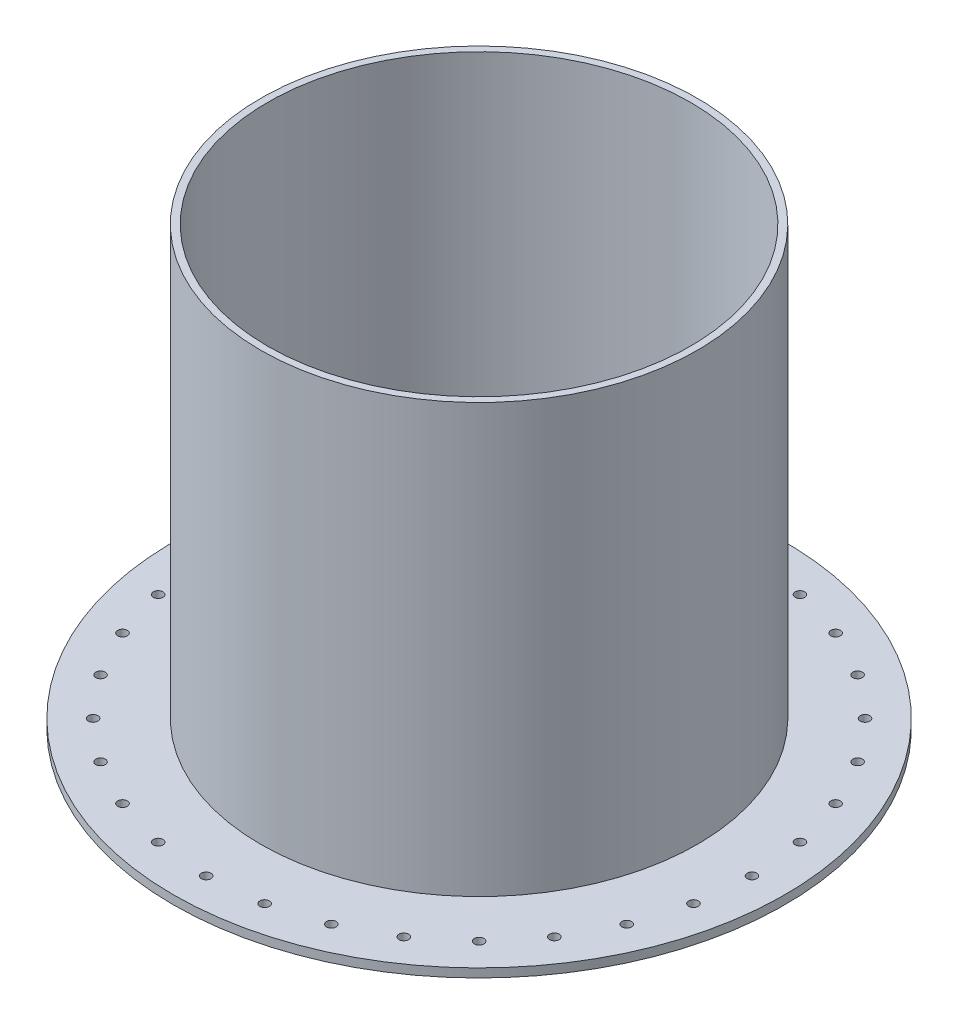
from build123d import *

# Parameters (mm, degrees)
SKETCH1_R           = 500
SKETCH1_R_2         = 484
BOSS_EXTRUDE1_DEPTH = 1000
SKETCH2_R           = 700
SKETCH2_R_2         = 450
SKETCH2_R_3         = 11
BOSS_EXTRUDE2_DEPTH = 20


with BuildPart() as part:
    # Sketch1 → Boss-Extrude1 (new body)
    with BuildSketch(Plane(origin=(0, 0, 0), x_dir=(1, 0, 0), z_dir=(0, 1, 0))):
        with Locations(Location((0, 0, 0), (0, 0, 270))):
            Circle(SKETCH1_R)
        with Locations(Location((0, 0, 0), (0, 0, 270))):
            Circle(SKETCH1_R_2, mode=Mode.SUBTRACT)
    extrude(amount=BOSS_EXTRUDE1_DEPTH)

    # Sketch2 → Boss-Extrude2 (add)
    with BuildSketch(Plane(origin=(0, 0, 0), x_dir=(1, 0, 0), z_dir=(0, 1, 0))):
        with Locations(Location((0, 0, 0), (0, 0, 270))):
            Circle(SKETCH2_R)
        with Locations(Location((0, 0, 0), (0, 0, 270))):
            Circle(SKETCH2_R_2, mode=Mode.SUBTRACT)
        with Locations(Location((0, 625, 0), (0, 0, 270))):
            Circle(SKETCH2_R_3, mode=Mode.SUBTRACT)
        with Locations(Location((121.93145126, 612.990800252, 0), (0, 0, 270))):
            Circle(SKETCH2_R_3, mode=Mode.SUBTRACT)
        with Locations(Location((239.177145228, 577.42470782, 0), (0, 0, 270))):
            Circle(SKETCH2_R_3, mode=Mode.SUBTRACT)
        with Locations(Location((347.231395637, 519.668507689, 0), (0, 0, 270))):
            Circle(SKETCH2_R_3, mode=Mode.SUBTRACT)
        with Locations(Location((441.941738242, 441.941738242, 0), (0, 0, 270))):
            Circle(SKETCH2_R_3, mode=Mode.SUBTRACT)
        with Locations(Location((519.668507689, 347.231395637, 0), (0, 0, 270))):
            Circle(SKETCH2_R_3, mode=Mode.SUBTRACT)
        with Locations(Location((577.42470782, 239.177145228, 0), (0, 0, 270))):
            Circle(SKETCH2_R_3, mode=Mode.SUBTRACT)
        with Locations(Location((612.990800252, 121.93145126, 0), (0, 0, 270))):
            Circle(SKETCH2_R_3, mode=Mode.SUBTRACT)
        with Locations(Location((625, 0, 0), (0, 0, 270))):
            Circle(SKETCH2_R_3, mode=Mode.SUBTRACT)
        with Locations(Location((612.990800252, -121.93145126, 0), (0, 0, 270))):
            Circle(SKETCH2_R_3, mode=Mode.SUBTRACT)
        with Locations(Location((577.42470782, -239.177145228, 0), (0, 0, 270))):
            Circle(SKETCH2_R_3, mode=Mode.SUBTRACT)
        with Locations(Location((519.668507689, -347.231395637, 0), (0, 0, 270))):
            Circle(SKETCH2_R_3, mode=Mode.SUBTRACT)
        with Locations(Location((441.941738242, -441.941738242, 0), (0, 0, 270))):
            Circle(SKETCH2_R_3, mode=Mode.SUBTRACT)
        with Locations(Location((347.231395637, -519.668507689, 0), (0, 0, 270))):
            Circle(SKETCH2_R_3, mode=Mode.SUBTRACT)
        with Locations(Location((239.177145228, -577.42470782, 0), (0, 0, 270))):
            Circle(SKETCH2_R_3, mode=Mode.SUBTRACT)
        with Locations(Location((121.93145126, -612.990800252, 0), (0, 0, 270))):
            Circle(SKETCH2_R_3, mode=Mode.SUBTRACT)
        with Locations(Location((0, -625, 0), (0, 0, 270))):
            Circle(SKETCH2_R_3, mode=Mode.SUBTRACT)
        with Locations(Location((-121.93145126, -612.990800252, 0), (0, 0, 270))):
            Circle(SKETCH2_R_3, mode=Mode.SUBTRACT)
        with Locations(Location((-239.177145228, -577.42470782, 0), (0, 0, 270))):
            Circle(SKETCH2_R_3, mode=Mode.SUBTRACT)
        with Locations(Location((-347.231395637, -519.668507689, 0), (0, 0, 270))):
            Circle(SKETCH2_R_3, mode=Mode.SUBTRACT)
        with Locations(Location((-441.941738242, -441.941738242, 0), (0, 0, 270))):
            Circle(SKETCH2_R_3, mode=Mode.SUBTRACT)
        with Locations(Location((-519.668507689, -347.231395637, 0), (0, 0, 270))):
            Circle(SKETCH2_R_3, mode=Mode.SUBTRACT)
        with Locations(Location((-577.42470782, -239.177145228, 0), (0, 0, 270))):
            Circle(SKETCH2_R_3, mode=Mode.SUBTRACT)
        with Locations(Location((-612.990800252, -121.93145126, 0), (0, 0, 270))):
            Circle(SKETCH2_R_3, mode=Mode.SUBTRACT)
        with Locations(Location((-625, 0, 0), (0, 0, 270))):
            Circle(SKETCH2_R_3, mode=Mode.SUBTRACT)
        with Locations(Location((-612.990800252, 121.93145126, 0), (0, 0, 270))):
            Circle(SKETCH2_R_3, mode=Mode.SUBTRACT)
        with Locations(Location((-577.42470782, 239.177145228, 0), (0, 0, 270))):
            Circle(SKETCH2_R_3, mode=Mode.SUBTRACT)
        with Locations(Location((-519.668507689, 347.231395637, 0), (0, 0, 270))):
            Circle(SKETCH2_R_3, mode=Mode.SUBTRACT)
        with Locations(Location((-441.941738242, 441.941738242, 0), (0, 0, 270))):
            Circle(SKETCH2_R_3, mode=Mode.SUBTRACT)
        with Locations(Location((-347.231395637, 519.668507689, 0), (0, 0, 270))):
            Circle(SKETCH2_R_3, mode=Mode.SUBTRACT)
        with Locations(Location((-239.177145228, 577.42470782, 0), (0, 0, 270))):
            Circle(SKETCH2_R_3, mode=Mode.SUBTRACT)
        with Locations(Location((-121.93145126, 612.990800252, 0), (0, 0, 270))):
            Circle(SKETCH2_R_3, mode=Mode.SUBTRACT)
    extrude(amount=BOSS_EXTRUDE2_DEPTH)


solid = part.part
